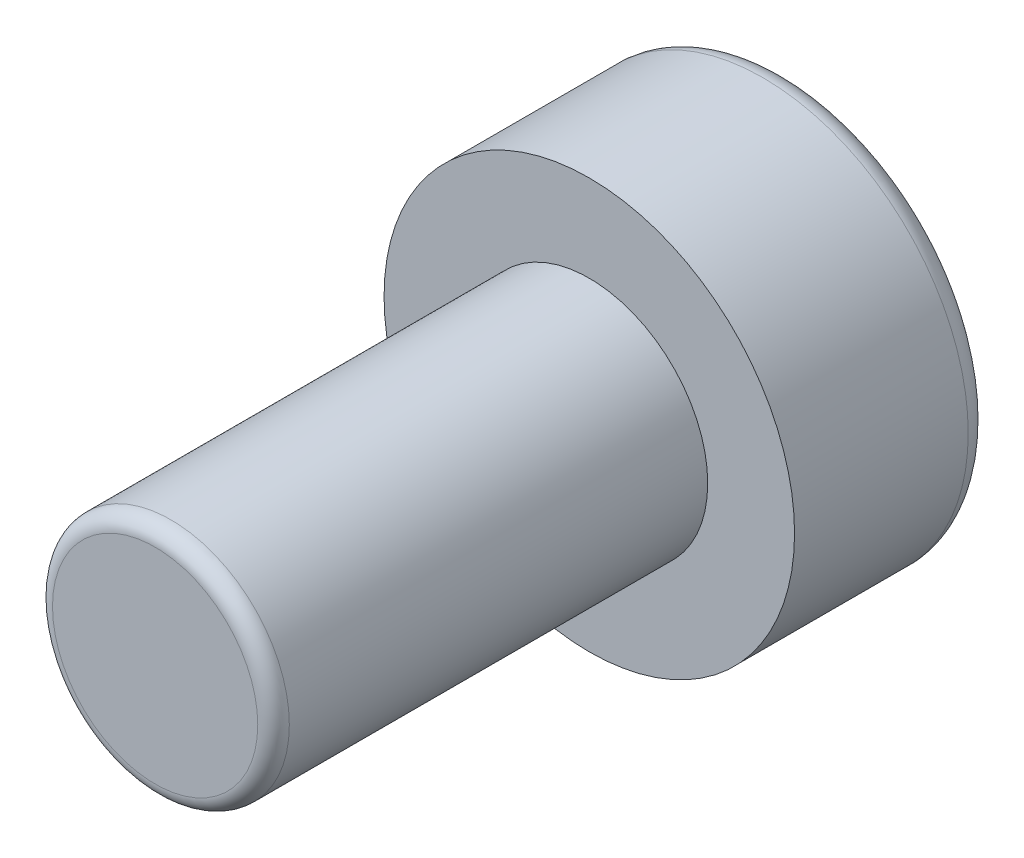
from build123d import *

# Parameters (mm, degrees)
SKETCH1_R           = 2.6
BOSS_EXTRUDE1_DEPTH = 2.5
FILLET1_R           = 0.3
SKETCH2_R           = 1.5
BOSS_EXTRUDE2_DEPTH = 5.5
FILLET2_R           = 0.2


with BuildPart() as part:
    # Sketch1 → Boss-Extrude1 (new body)
    with BuildSketch(Plane.XY):
        Circle(SKETCH1_R)
    extrude(amount=BOSS_EXTRUDE1_DEPTH)

    # Fillet1
    fillet1_edges = [part.edges().sort_by_distance(p)[0] for p in [
        (-2.6, 0, 0),
    ]]
    fillet(fillet1_edges, radius=FILLET1_R)

    # Sketch2 → Boss-Extrude2 (add)
    with BuildSketch(Plane.XY.offset(2.5)):
        Circle(SKETCH2_R)
    extrude(amount=BOSS_EXTRUDE2_DEPTH)

    # Fillet2
    fillet2_edges = [part.edges().sort_by_distance(p)[0] for p in [
        (-1.5, 0, 8),
    ]]
    fillet(fillet2_edges, radius=FILLET2_R)


solid = part.part
